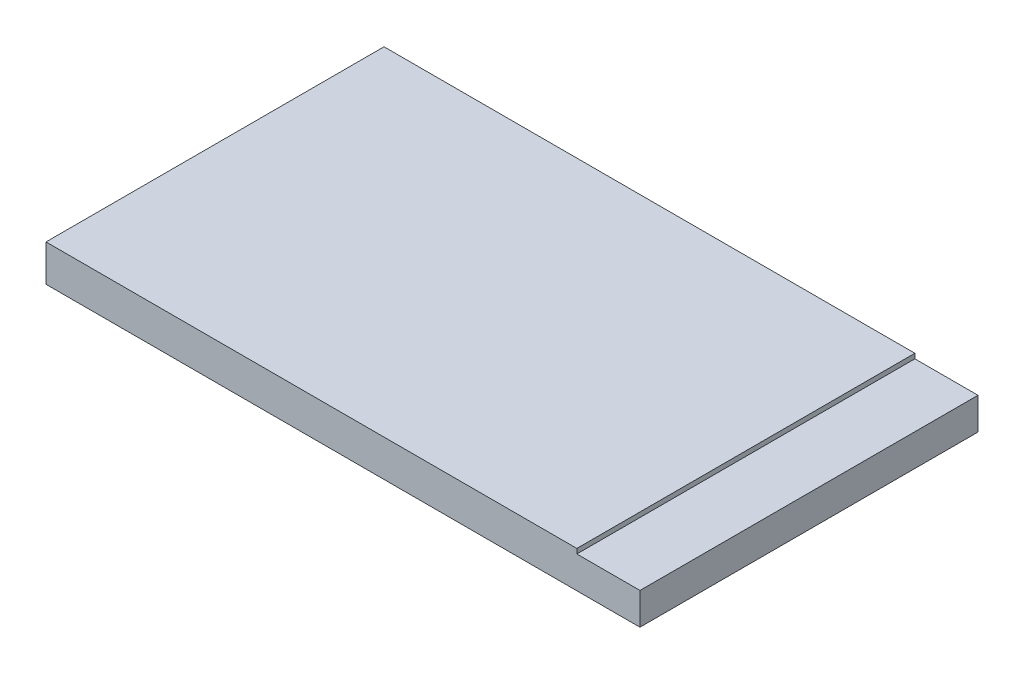
from build123d import *

# Parameters (mm, degrees)
SKETCH1_W           = 31.242
SKETCH1_H           = 17.78
BOSS_EXTRUDE1_DEPTH = 1.6764
SKETCH2_W           = 27.921676166
SKETCH2_H           = 17.78
BOSS_EXTRUDE2_DEPTH = 0.254


with BuildPart() as part:
    # Sketch1 → Boss-Extrude1 (new body)
    with BuildSketch(Plane(origin=(0, 0, 0), x_dir=(1, 0, 0), z_dir=(0, 1, 0))):
        Rectangle(SKETCH1_W, SKETCH1_H)
    extrude(amount=BOSS_EXTRUDE1_DEPTH)

    # Sketch2 → Boss-Extrude2 (add)
    with BuildSketch(Plane(origin=(0, 1.6764, 0), x_dir=(1, 0, 0), z_dir=(0, 1, 0))):
        with Locations((-1.660161917, 0)):
            Rectangle(SKETCH2_W, SKETCH2_H)
    extrude(amount=BOSS_EXTRUDE2_DEPTH)


solid = part.part
